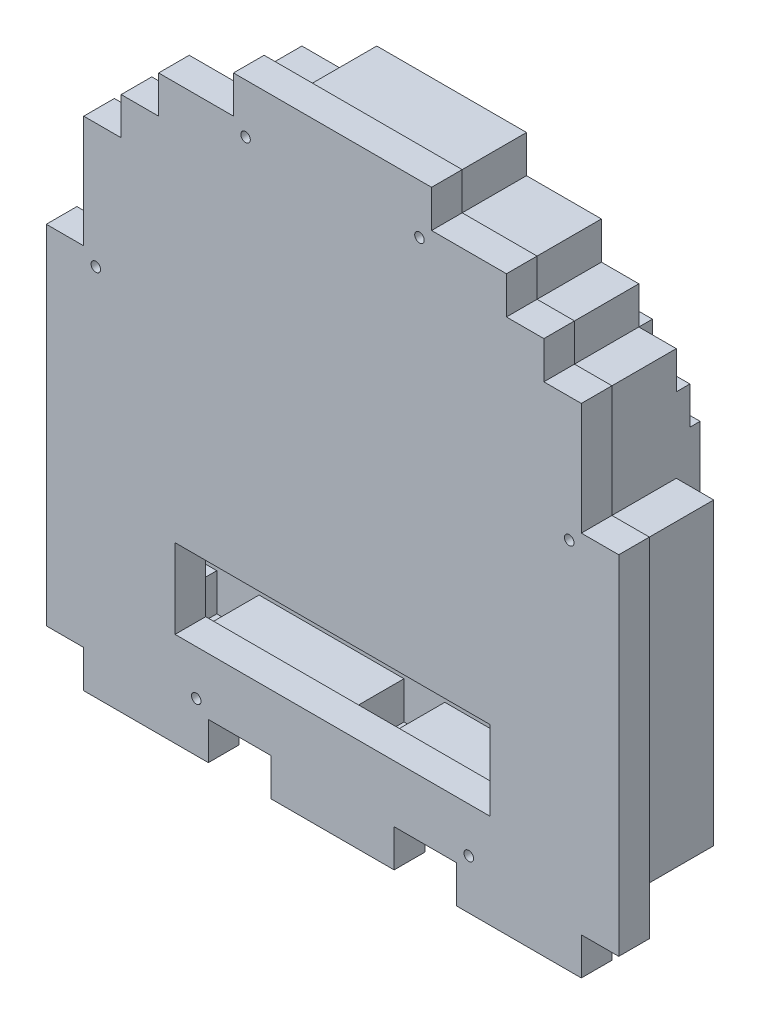
from build123d import *

# Parameters (mm, degrees)
SALIENTE_EXTRUIR1_DEPTH = 9
CROQUIS4_W              = 92.524179437
CROQUIS4_H              = 23.337512491
CROQUIS4_R              = 1.4
CORTAR_EXTRUIR1_DEPTH   = 130.69901246
SALIENTE_EXTRUIR2_DEPTH = 18
SALIENTE_EXTRUIR3_DEPTH = 8
SALIENTE_EXTRUIR4_DEPTH = 4
CROQUIS9_W              = 22
CROQUIS9_H              = 22
SALIENTE_EXTRUIR5_DEPTH = 3


with BuildPart() as part:
    # Croquis3 → Saliente-Extruir1 (new body)
    with BuildSketch(Plane.XY):
        Polygon((-78.930426729, 27.657765941), (-78.930426729, -74.542234059), (-67.930426729, -74.542234059), (-67.930426729, -85.542234059), (-31.316827161, -85.542234059), (-31.316827161, -74.542234059), (-12.930426729, -74.542234059), (-12.930426729, -85.542234059), (23.269573271, -85.542234059), (23.269573271, -74.542234059), (41.655973703, -74.542234059), (41.655973703, -85.542234059), (78.269573271, -85.542234059), (78.269573271, -74.542234059), (89.269573271, -74.542234059), (89.269573271, 27.657765941), (78.269573271, 27.657765941), (78.269573271, 60.657765941), (67.269573271, 60.657765941), (67.269573271, 71.657765942), (56.269573271, 71.657765942), (56.269573271, 82.657765942), (34.269573271, 82.657765942), (34.269573271, 93.657765942), (-23.930426729, 93.657765942), (-23.930426729, 82.657765942), (-45.930426729, 82.657765942), (-45.930426729, 71.657765942), (-56.930426729, 71.657765942), (-56.930426729, 60.657765941), (-67.930426729, 60.657765941), (-67.930426729, 27.657765941), align=None)
    extrude(amount=-SALIENTE_EXTRUIR1_DEPTH)

    # Croquis4 → Cortar-Extruir1 (cut, through all)
    with BuildSketch(Plane(origin=(0, 0, -9), x_dir=(-1, 0, 0), z_dir=(0, 0, -1))):
        with Locations((-5.16957327, -46.12250801)):
            Rectangle(CROQUIS4_W, CROQUIS4_H)
        with Locations((-74.719573271, 24.107765941)):
            Circle(CROQUIS4_R)
        with Locations((-30.719573271, 79.107765942)):
            Circle(CROQUIS4_R)
        with Locations(Location((20.380426729, 79.107765942, 0), (0, 0, 180))):
            Circle(CROQUIS4_R)
        with Locations(Location((34.866827161, -70.992234059, 0), (0, 0, 180))):
            Circle(CROQUIS4_R)
        with Locations(Location((64.380426729, 24.107765941, 0), (0, 0, 180))):
            Circle(CROQUIS4_R)
        with Locations((-45.205973703, -70.992234059)):
            Circle(CROQUIS4_R)
    extrude(amount=-CORTAR_EXTRUIR1_DEPTH, mode=Mode.SUBTRACT)

    # Croquis5 → Saliente-Extruir2 (add)
    with BuildSketch(Plane(origin=(0, 0, -9), x_dir=(-1, 0, 0), z_dir=(0, 0, -1))):
        Polygon((71.830426729, 20.557765941), (60.830426729, 20.557765941), (60.830426729, 53.557765941), (49.830426729, 53.557765941), (49.830426729, 64.557765942), (38.830426729, 64.557765942), (38.830426729, 75.557765942), (16.830426729, 75.557765942), (16.830426729, 86.557765942), (-27.169573271, 86.557765942), (-27.169573271, 75.557765942), (-49.169573271, 75.557765942), (-49.169573271, 64.557765942), (-60.169573271, 64.557765942), (-60.169573271, 53.557765941), (-71.169573271, 53.557765941), (-71.169573271, 20.557765941), (-82.169573271, 20.557765941), (-82.169573271, -67.442234059), (-71.169573271, -67.442234059), (-71.169573271, -78.442234059), (-48.755973703, -78.442234059), (-48.755973703, -67.442234059), (-16.169573271, -67.442234059), (-16.169573271, -78.442234059), (5.830426729, -78.442234059), (5.830426729, -67.442234059), (38.416827161, -67.442234059), (38.416827161, -78.442234059), (60.830426729, -78.442234059), (60.830426729, -67.442234059), (71.830426729, -67.442234059), align=None)
        Polygon((-66.169573271, 48.557765941), (-66.169573271, 15.557765941), (-77.169573271, 15.557765941), (-77.169573271, -62.442234059), (-66.169573271, -62.442234059), (-66.169573271, -73.442234059), (-53.755973703, -73.442234059), (-53.755973703, -62.442234059), (-11.169573271, -62.442234059), (-11.169573271, -73.442234059), (0.830426729, -73.442234059), (0.830426729, -62.442234059), (43.416827161, -62.442234059), (43.416827161, -73.442234059), (55.830426729, -73.442234059), (55.830426729, -62.442234059), (66.830426729, -62.442234059), (66.830426729, 15.557765941), (55.830426729, 15.557765941), (55.830426729, 48.557765941), (44.830426729, 48.557765941), (44.830426729, 59.557765942), (33.830426729, 59.557765942), (33.830426729, 70.557765942), (11.830426729, 70.557765942), (11.830426729, 81.557765942), (-22.169573271, 81.557765942), (-22.169573271, 70.557765942), (-44.169573271, 70.557765942), (-44.169573271, 59.557765942), (-55.169573271, 59.557765942), (-55.169573271, 48.557765941), align=None, mode=Mode.SUBTRACT)
    extrude(amount=SALIENTE_EXTRUIR2_DEPTH)

    # Croquis7 → Saliente-Extruir3 (add)
    with BuildSketch(Plane(origin=(0, 0, -27), x_dir=(-1, 0, 0), z_dir=(0, 0, -1))):
        Polygon((71.830426729, -67.442234059), (71.830426729, 20.557765941), (60.830426729, 20.557765941), (60.830426729, 53.557765941), (49.830426729, 53.557765941), (49.830426729, 64.557765942), (38.830426729, 64.557765942), (38.830426729, 75.557765942), (16.830426729, 75.557765942), (16.830426729, 86.557765942), (-27.169573271, 86.557765942), (-27.169573271, 75.557765942), (-49.169573271, 75.557765942), (-49.169573271, 64.557765942), (-60.169573271, 64.557765942), (-60.169573271, 53.557765941), (-71.169573271, 53.557765941), (-71.169573271, 20.557765941), (-82.169573271, 20.557765941), (-82.169573271, -67.442234059), (-71.169573271, -67.442234059), (-71.169573271, -78.442234059), (-48.755973703, -78.442234059), (-48.755973703, -67.442234059), (-16.169573271, -67.442234059), (-16.169573271, -78.442234059), (5.830426729, -78.442234059), (5.830426729, -67.442234059), (38.416827161, -67.442234059), (38.416827161, -78.442234059), (60.830426729, -78.442234059), (60.830426729, -67.442234059), align=None)
    extrude(amount=SALIENTE_EXTRUIR3_DEPTH)

    # Croquis8 → Saliente-Extruir4 (add)
    with BuildSketch(Plane(origin=(0, 0, -35), x_dir=(-1, 0, 0), z_dir=(0, 0, -1))):
        Polygon((-71.169573271, 20.557765941), (-71.169573271, 9.557765941), (-60.169573271, 9.557765941), (-60.169573271, -1.442234059), (-38.169573271, -1.442234059), (-38.169573271, 9.557765941), (-27.169573271, 9.557765941), (-27.169573271, 20.557765941), (-27.169573271, 42.557765941), (-38.169573271, 42.557765941), (-38.169573271, 53.557765941), (-60.169573271, 53.557765941), (-60.169573271, 42.557765941), (-71.169573271, 42.557765941), align=None)
        Polygon((38.830426729, 20.557765941), (38.830426729, 9.557765941), (27.830426729, 9.557765941), (27.830426729, -1.442234059), (5.830426729, -1.442234059), (5.830426729, 9.557765941), (-5.169573271, 9.557765941), (-5.169573271, 20.557765941), (-5.169573271, 42.557765941), (5.830426729, 42.557765941), (5.830426729, 53.557765941), (27.830426729, 53.557765941), (27.830426729, 42.557765941), (38.830426729, 42.557765941), align=None)
    extrude(amount=SALIENTE_EXTRUIR4_DEPTH)

    # Croquis9 → Saliente-Extruir5 (add)
    with BuildSketch(Plane(origin=(0, 0, -39), x_dir=(-1, 0, 0), z_dir=(0, 0, -1))):
        with Locations((-60.169573271, 20.557765941)):
            Rectangle(CROQUIS9_W, CROQUIS9_H)
        with Locations((5.830426729, 20.557765941)):
            Rectangle(CROQUIS9_W, CROQUIS9_H)
    extrude(amount=SALIENTE_EXTRUIR5_DEPTH)


solid = part.part
